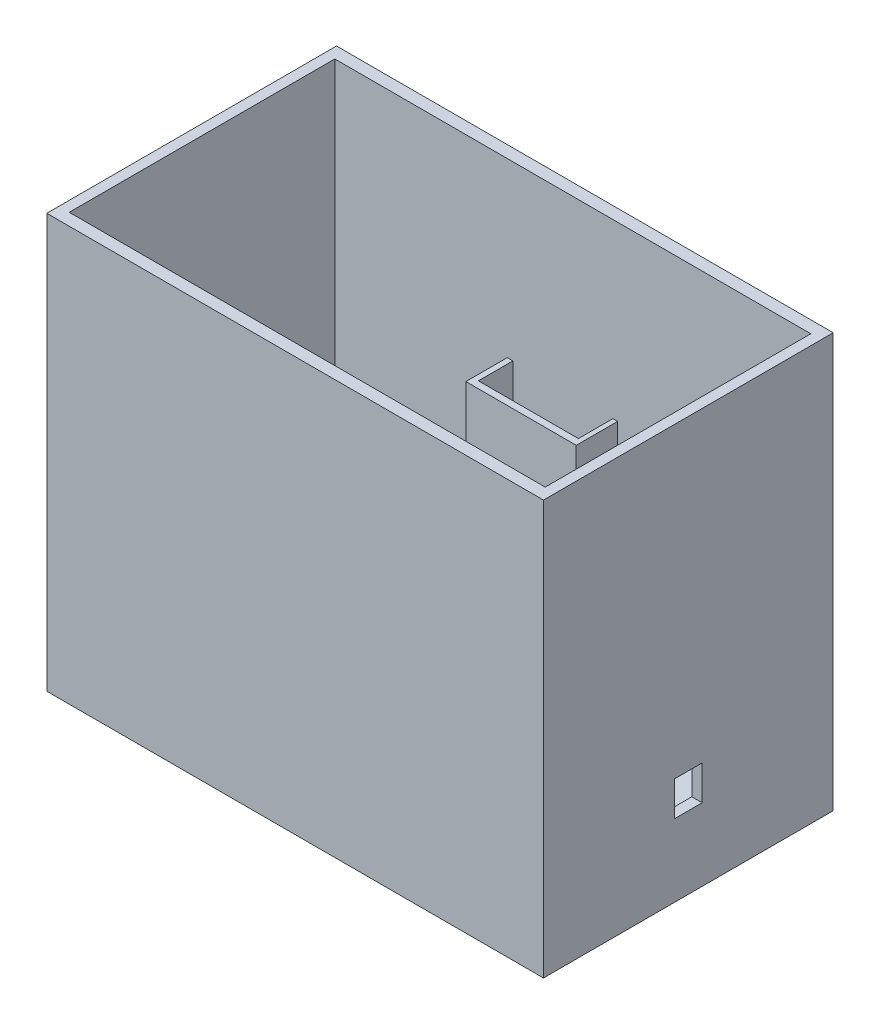
from build123d import *

# Parameters (mm, degrees)
SKETCH1_W           = 144
SKETCH1_H           = 84
BOSS_EXTRUDE1_DEPTH = 120
SKETCH2_W           = 138
SKETCH2_H           = 77
CUT_EXTRUDE1_DEPTH  = 100
SKETCH3_R           = 4
CUT_EXTRUDE3_DEPTH  = 50
SKETCH5_W           = 8
SKETCH5_H           = 10
CUT_EXTRUDE4_DEPTH  = 20
SKETCH4_W           = 32
SKETCH4_H           = 12
BOSS_EXTRUDE4_DEPTH = 45
SKETCH4_2_W         = 32
SKETCH4_2_H         = 12
BOSS_EXTRUDE5_DEPTH = 45
SKETCH11_W          = 29
SKETCH11_H          = 10
CUT_EXTRUDE5_DEPTH  = 45


with BuildPart() as part:
    # Sketch1 → Boss-Extrude1 (new body)
    with BuildSketch(Plane(origin=(0, 0, 0), x_dir=(1, 0, 0), z_dir=(0, 1, 0))):
        Rectangle(SKETCH1_W, SKETCH1_H)
    extrude(amount=BOSS_EXTRUDE1_DEPTH)

    # Sketch2 → Cut-Extrude1 (cut)
    with BuildSketch(Plane(origin=(0, 120, 0), x_dir=(1, 0, 0), z_dir=(0, 1, 0))):
        Rectangle(SKETCH2_W, SKETCH2_H)
    extrude(amount=-CUT_EXTRUDE1_DEPTH, mode=Mode.SUBTRACT)

    # Sketch3 → Cut-Extrude3 (cut, symmetric)
    with BuildSketch(Plane.ZY.offset(72)):
        with Locations((-25, 24)):
            Circle(SKETCH3_R)
    extrude(amount=CUT_EXTRUDE3_DEPTH, both=True, mode=Mode.SUBTRACT)

    # Sketch5 → Cut-Extrude4 (cut, symmetric)
    with BuildSketch(Plane(origin=(72, 0, 0), x_dir=(0, 0, -1), z_dir=(1, 0, 0))):
        with Locations((0, 26)):
            Rectangle(SKETCH5_W, SKETCH5_H)
    extrude(amount=CUT_EXTRUDE4_DEPTH, both=True, mode=Mode.SUBTRACT)

    # Sketch4 → Boss-Extrude4 (add)
    with BuildSketch(Plane(origin=(0, 25, 0), x_dir=(1, 0, 0), z_dir=(0, 1, 0))):
        with Locations((-3, 32.5)):
            Rectangle(SKETCH4_W, SKETCH4_H)
    extrude(amount=BOSS_EXTRUDE4_DEPTH)

    # Sketch4<2> → Boss-Extrude5 (add)
    with BuildSketch(Plane(origin=(0, 25, 0), x_dir=(1, 0, 0), z_dir=(0, 1, 0))):
        with Locations((-3, 32.5)):
            Rectangle(SKETCH4_2_W, SKETCH4_2_H)
    extrude(amount=BOSS_EXTRUDE5_DEPTH)

    # Sketch11 → Cut-Extrude5 (cut)
    with BuildSketch(Plane(origin=(0, 70, 0), x_dir=(1, 0, 0), z_dir=(0, 1, 0))):
        with Locations((-2.873413599, 33.5)):
            Rectangle(SKETCH11_W, SKETCH11_H)
    extrude(amount=-CUT_EXTRUDE5_DEPTH, mode=Mode.SUBTRACT)


solid = part.part
